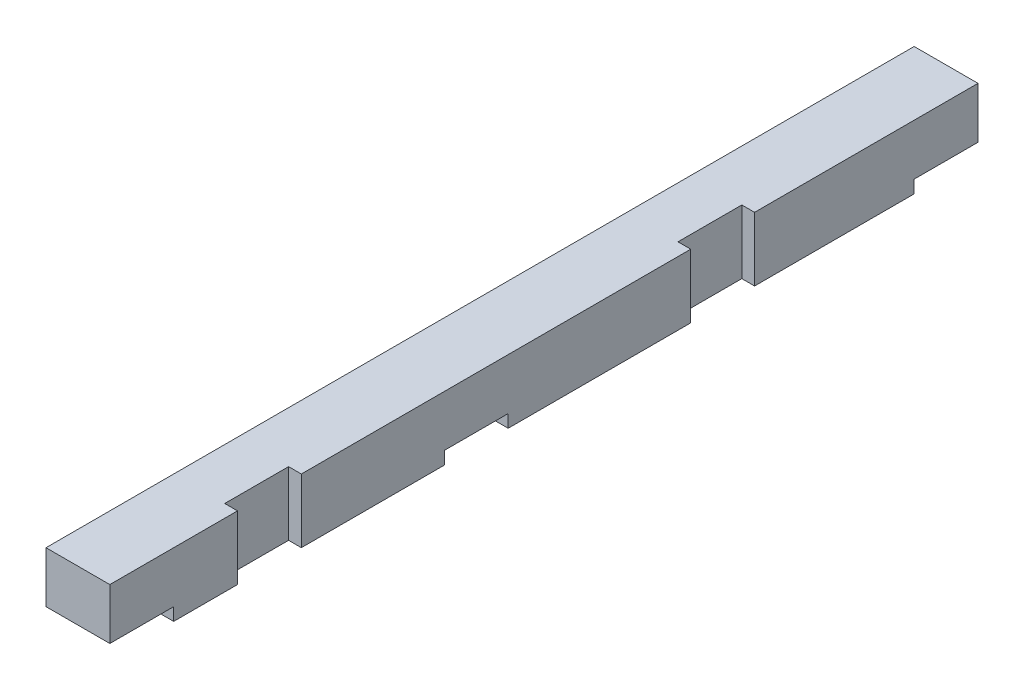
from build123d import *

# Parameters (mm, degrees)
ESQUISSE1_W             = 10
ESQUISSE1_H             = 10
BOSS_EXTRU_1_DEPTH      = 136
ESQUISSE2_W             = 10
ESQUISSE2_H             = 2
ENL_V_MAT_EXTRU_1_DEPTH = 137.733317081
ESQUISSE3_W             = 10
ESQUISSE3_H             = 10
ENL_V_MAT_EXTRU_2_DEPTH = 2
ESQUISSE4_W             = 10
ESQUISSE4_H             = 10
ENL_V_MAT_EXTRU_3_DEPTH = 2


with BuildPart() as part:
    # Esquisse1 → Boss.-Extru.1 (new body)
    with BuildSketch(Plane.XY):
        with Locations((5, 5)):
            Rectangle(ESQUISSE1_W, ESQUISSE1_H)
    extrude(amount=BOSS_EXTRU_1_DEPTH)

    # Esquisse2 → Enlèv. mat.-Extru.1 (cut, through all)
    with BuildSketch(Plane(origin=(10, 0, 0), x_dir=(0, 0, -1), z_dir=(1, 0, 0))):
        with Locations((-131, 1)):
            Rectangle(ESQUISSE2_W, ESQUISSE2_H)
        with Locations((-78.6, 1)):
            Rectangle(ESQUISSE2_W, ESQUISSE2_H)
        with Locations((-5, 1)):
            Rectangle(ESQUISSE2_W, ESQUISSE2_H)
    extrude(amount=-ENL_V_MAT_EXTRU_1_DEPTH, mode=Mode.SUBTRACT)

    # Esquisse3 → Enlèv. mat.-Extru.2 (cut)
    with BuildSketch(Plane(origin=(10, 0, 0), x_dir=(0, 0, -1), z_dir=(1, 0, 0))):
        with Locations((-40, 5)):
            Rectangle(ESQUISSE3_W, ESQUISSE3_H)
    extrude(amount=-ENL_V_MAT_EXTRU_2_DEPTH, mode=Mode.SUBTRACT)

    # Esquisse4 → Enlèv. mat.-Extru.3 (cut)
    with BuildSketch(Plane(origin=(10, 0, 0), x_dir=(0, 0, -1), z_dir=(1, 0, 0))):
        with Locations((-111, 5)):
            Rectangle(ESQUISSE4_W, ESQUISSE4_H)
    extrude(amount=-ENL_V_MAT_EXTRU_3_DEPTH, mode=Mode.SUBTRACT)


solid = part.part
